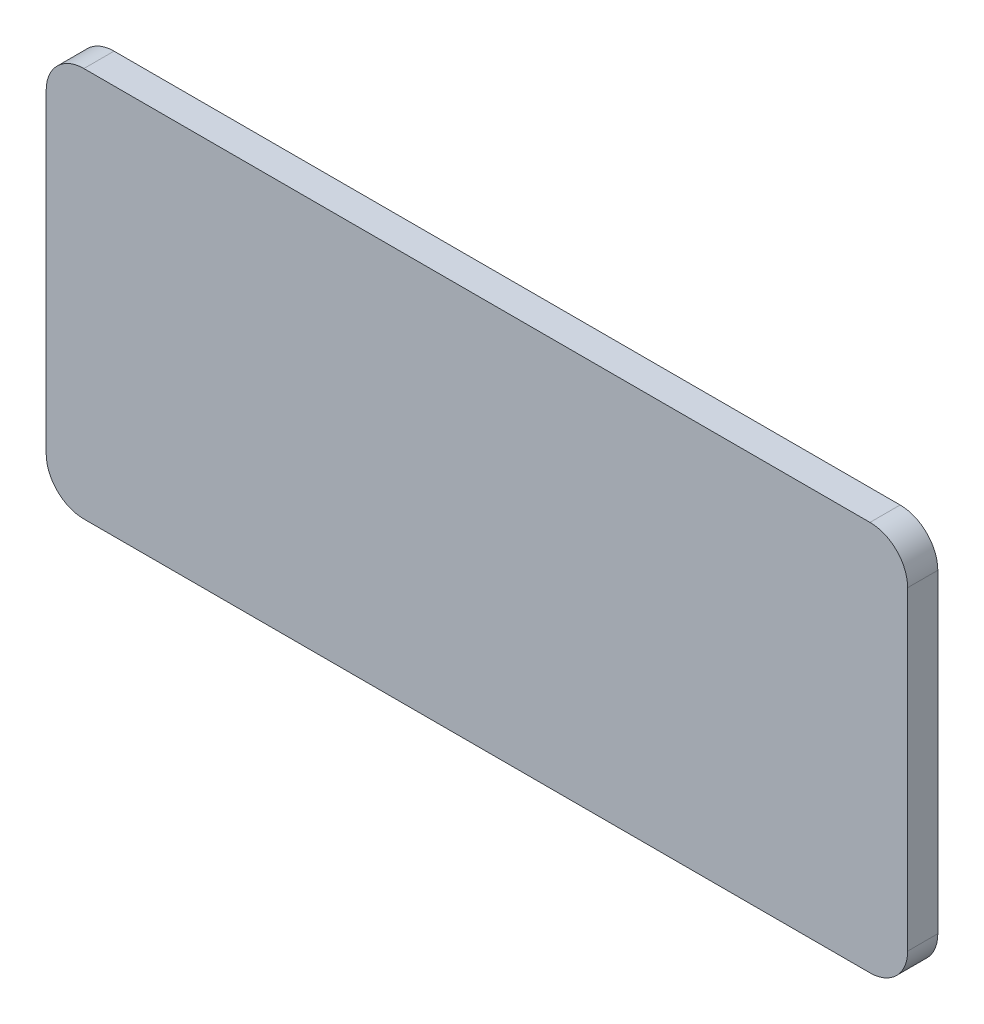
from build123d import *

# Parameters (mm, degrees)
ESQUISSE1_W        = 45.71
ESQUISSE1_H        = 20.7
BOSS_EXTRU_1_DEPTH = 1.6
CONG_1_R           = 2


with BuildPart() as part:
    # Esquisse1 → Boss.-Extru.1 (new body)
    with BuildSketch(Plane.XY):
        Rectangle(ESQUISSE1_W, ESQUISSE1_H)
    extrude(amount=BOSS_EXTRU_1_DEPTH)

    # Congé1
    cong_1_edges = [part.edges().sort_by_distance(p)[0] for p in [
        (-22.855, 10.35, 0.8),
        (22.855, 10.35, 0.8),
        (22.855, -10.35, 0.8),
        (-22.855, -10.35, 0.8),
    ]]
    fillet(cong_1_edges, radius=CONG_1_R)


solid = part.part
